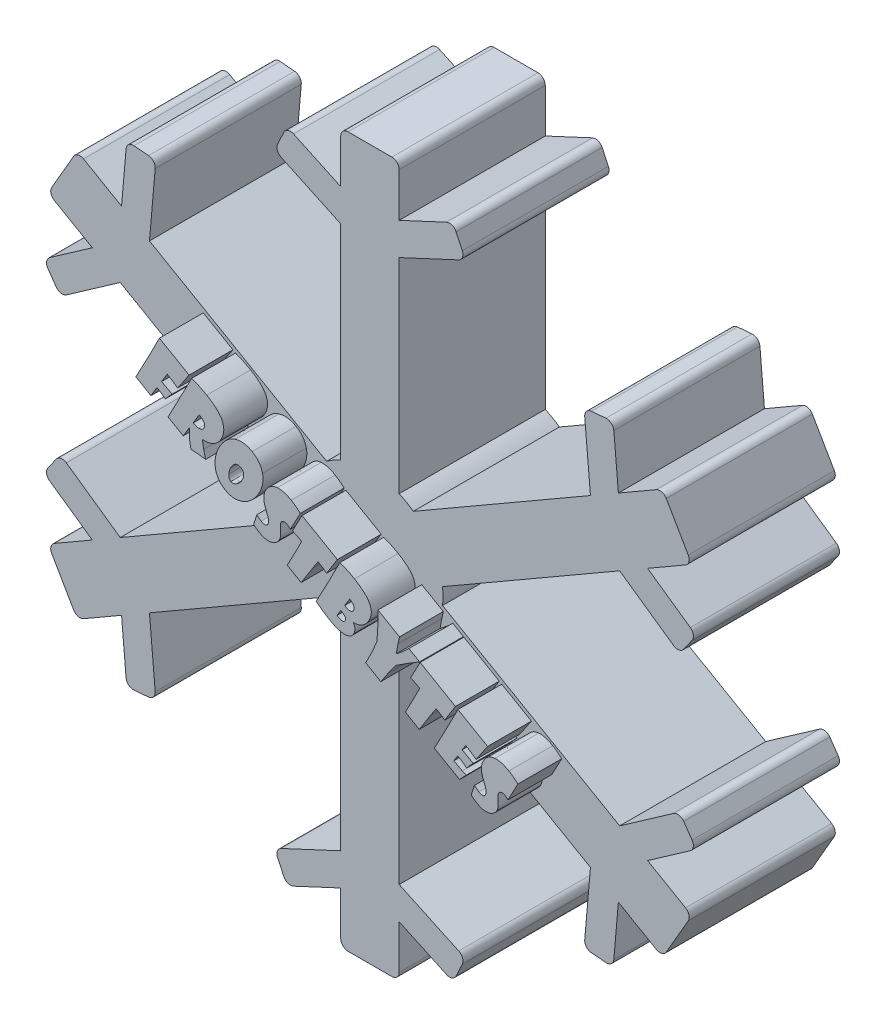
from build123d import *

# Parameters (mm, degrees)
SKETCH2_R           = 5
BOSS_EXTRUDE1_DEPTH = 10
BOSS_EXTRUDE2_DEPTH = 10
CIRPATTERN1_COUNT   = 6
BOSS_EXTRUDE3_DEPTH = 3


with BuildPart() as part:
    # Sketch2 → Boss-Extrude1 (new body)
    with BuildSketch(Plane.XY):
        Circle(SKETCH2_R)
    extrude(amount=-BOSS_EXTRUDE1_DEPTH)

    # Sketch3 → Boss-Extrude2 (add)
    with BuildSketch(Plane.XY):
        Polygon((-2, 18.582575695), (-2, 4.582575695), (0, 4.582575695), (2, 4.582575695), (2, 18.582575695), (0, 18.582575695), align=None)
        with BuildLine():
            Line((-6.078385042, 20.484357873), (-2, 18.582575695))
            Line((-2, 18.582575695), (0, 18.582575695))
            Line((0, 18.582575695), (0, 24.289331533))
            Line((0, 24.289331533), (-1.5, 24.289331533))
            ThreePointArc((-1.5, 24.289331533), (-1.853553391, 24.142884923), (-2, 23.789331533))
            Line((-2, 23.789331533), (-2, 20.789331533))
            Line((-2, 20.789331533), (-5.233148518, 22.296973447))
            ThreePointArc((-5.233148518, 22.296973447), (-5.615467721, 22.313665864), (-5.897611543, 22.055128684))
            Line((-5.897611543, 22.055128684), (-6.320229804, 21.148820897))
            ThreePointArc((-6.320229804, 21.148820897), (-6.336922221, 20.766501695), (-6.078385042, 20.484357873))
        make_face()
        with BuildLine():
            Line((0, 24.289331533), (0, 18.582575695))
            Line((0, 18.582575695), (2, 18.582575695))
            Line((2, 18.582575695), (6.078385042, 20.484357873))
            ThreePointArc((6.078385042, 20.484357873), (6.336922221, 20.766501695), (6.320229804, 21.148820897))
            Line((6.320229804, 21.148820897), (5.897611543, 22.055128684))
            ThreePointArc((5.897611543, 22.055128684), (5.615467721, 22.313665864), (5.233148518, 22.296973447))
            Line((5.233148518, 22.296973447), (2, 20.789331533))
            Line((2, 20.789331533), (2, 23.789331533))
            ThreePointArc((2, 23.789331533), (1.853553391, 24.142884923), (1.5, 24.289331533))
            Line((1.5, 24.289331533), (0, 24.289331533))
        make_face()
    boss_extrude2 = extrude(amount=-BOSS_EXTRUDE2_DEPTH)

    # CirPattern1: Boss-Extrude2 ×6 about axis
    cirpattern1_axis = Axis((0, 0, 0), (0, 0, 1))
    for i in range(1, CIRPATTERN1_COUNT):
        add(boss_extrude2.rotate(cirpattern1_axis, i * 360 / CIRPATTERN1_COUNT))

    # Sketch4 → Boss-Extrude3 (add)
    # profile 1 of 10: a face of its own
    with BuildSketch(Plane.XY):
        with BuildLine():
            Line((-9.378683004, 7.426874525), (-10.163887479, 6.266959401))
            add(Edge.make_bspline(
                [(-10.163887479, 6.266959401), (-10.171047513, 6.272640723), (-10.187165293, 6.285429811), (-10.215057295, 6.305332481), (-10.248078043, 6.329718594), (-10.286482146, 6.358271247), (-10.331004494, 6.389749995), (-10.381162603, 6.424802307), (-10.43638991, 6.464250832), (-10.475539238, 6.491174207), (-10.496063405, 6.505288877)],
                knots=[0, 0, 0, 0, 0.536428421, 1.207541116, 2.010745698, 2.94604434, 4.016377097, 5.211130026, 6.537925522, 8, 8, 8, 8], degree=3))
            add(Edge.make_bspline(
                [(-10.496063405, 6.505288877), (-10.523708, 6.522676937), (-10.581280358, 6.558889137), (-10.67181167, 6.614163995), (-10.769998639, 6.673025086), (-10.838118521, 6.713275227), (-10.873474671, 6.734166192)],
                knots=[0, 0, 0, 0, 0.887834416, 1.84899509, 2.88356745, 4, 4, 4, 4], degree=3))
            Line((-10.873474671, 6.734166192), (-11.266414486, 6.096820513))
            add(Edge.make_bspline(
                [(-11.266414486, 6.096820513), (-11.245972067, 6.084827907), (-11.202583419, 6.059373827), (-11.132941804, 6.020378342), (-11.055033227, 5.977488834), (-10.968146942, 5.932016622), (-10.872940444, 5.882749631), (-10.769668846, 5.829800606), (-10.657215022, 5.774740385), (-10.579550616, 5.736526587), (-10.539273282, 5.71670863)],
                knots=[0, 0, 0, 0, 0.693056589, 1.470999547, 2.333960976, 3.293661248, 4.338596418, 5.468814886, 6.687308705, 8, 8, 8, 8], degree=3))
            add(Edge.make_bspline(
                [(-10.539273282, 5.71670863), (-10.553959532, 5.701911338), (-10.587260698, 5.668358382), (-10.641822425, 5.610412049), (-10.708565434, 5.540544745), (-10.756912014, 5.489645219), (-10.783003992, 5.462175451)],
                knots=[0, 0, 0, 0, 0.709865812, 1.609625323, 2.709947953, 4, 4, 4, 4], degree=3))
            add(Edge.make_bspline(
                [(-10.783003992, 5.462175451), (-10.799907177, 5.443292789), (-10.835209568, 5.403856253), (-10.890232438, 5.341384745), (-10.949252015, 5.273010397), (-10.989653894, 5.225016003), (-11.010530998, 5.200215574)],
                knots=[0, 0, 0, 0, 0.876433904, 1.830436725, 2.878908645, 4, 4, 4, 4], degree=3))
            add(Edge.make_bspline(
                [(-11.010530998, 5.200215574), (-11.01572087, 5.204474641), (-11.02770429, 5.214308831), (-11.047632629, 5.231425552), (-11.073281064, 5.250460078), (-11.103405825, 5.272927184), (-11.137411662, 5.299376692), (-11.176857434, 5.328252618), (-11.220689314, 5.360730823), (-11.251553067, 5.38341822), (-11.267764794, 5.395335173)],
                knots=[0, 0, 0, 0, 0.498986376, 1.15215995, 1.951693674, 2.871627046, 3.945487077, 5.153127236, 6.50463025, 8, 8, 8, 8], degree=3))
            add(Edge.make_bspline(
                [(-11.267764794, 5.395335173), (-11.319120259, 5.42953103), (-11.421357166, 5.497607109), (-11.528425565, 5.557798165), (-11.581711553, 5.587754154)],
                knots=[0, 0, 0, 0, 1.004636511, 2, 2, 2, 2], degree=3))
            Line((-11.581711553, 5.587754154), (-11.989504763, 4.90112221))
            Line((-11.989504763, 4.90112221), (-13.0265418, 5.499984093))
            Line((-13.0265418, 5.499984093), (-12.187324979, 7.074443969))
            add(Edge.make_bspline(
                [(-12.187324979, 7.074443969), (-12.161760442, 7.121633764), (-12.108240809, 7.220426107), (-12.027124771, 7.376708194), (-11.938310306, 7.546086583), (-11.843804266, 7.729628196), (-11.744165181, 7.9274843), (-11.638130396, 8.139127327), (-11.525124688, 8.364279642), (-11.448812691, 8.519665511), (-11.409547202, 8.59961758)],
                knots=[0, 0, 0, 0, 0.752299695, 1.574947481, 2.468124134, 3.433183194, 4.468725331, 5.573389339, 6.751414492, 8, 8, 8, 8], degree=3))
            Line((-11.409547202, 8.59961758), (-9.378683004, 7.426874525))
        make_face()
    # profile 2 of 10: a face of its own
    with BuildSketch(Plane.XY):
        with BuildLine():
            add(Edge.make_bspline(
                [(-7.210011759, 4.68709829), (-7.227964809, 4.657285687), (-7.263435695, 4.598383195), (-7.324733072, 4.516790065), (-7.390442324, 4.441216974), (-7.461649969, 4.37219955), (-7.537689842, 4.309239045), (-7.619560641, 4.253721283), (-7.705952126, 4.204088784), (-7.766774746, 4.176428839), (-7.797396018, 4.162503383)],
                knots=[0, 0, 0, 0, 1.041083224, 2.056928592, 3.049936458, 4.03604286, 5.021896133, 6.000959734, 6.993579095, 8, 8, 8, 8], degree=3))
            add(Edge.make_bspline(
                [(-7.797396018, 4.162503383), (-7.824959142, 4.151829648), (-7.879743627, 4.130614524), (-7.963503267, 4.104665593), (-8.048086667, 4.086284993), (-8.132743219, 4.072043913), (-8.217903435, 4.065936158), (-8.303381916, 4.064025315), (-8.389341679, 4.069719932), (-8.446484863, 4.077545463), (-8.475250956, 4.081484864)],
                knots=[0, 0, 0, 0, 1.025579071, 2.038441697, 3.038853042, 4.02748938, 5.014613074, 5.998766479, 6.99257155, 8, 8, 8, 8], degree=3))
            add(Edge.make_bspline(
                [(-8.475250956, 4.081484864), (-8.473944244, 4.069327153), (-8.470987846, 4.041820676), (-8.464913028, 3.995863175), (-8.455844905, 3.940573351), (-8.445062631, 3.875755679), (-8.432306456, 3.801207956), (-8.416625284, 3.717330528), (-8.399230928, 3.62385938), (-8.386209487, 3.558675166), (-8.379379043, 3.52448255)],
                knots=[0, 0, 0, 0, 0.519081358, 1.17440686, 1.967604465, 2.897422788, 3.963905213, 5.178180886, 6.519804552, 8, 8, 8, 8], degree=3))
            add(Edge.make_bspline(
                [(-8.379379043, 3.52448255), (-8.37636149, 3.507801259), (-8.370019344, 3.472741323), (-8.357340435, 3.418478426), (-8.34430007, 3.359295053), (-8.327481732, 3.296088756), (-8.310444409, 3.227643611), (-8.289804382, 3.154884041), (-8.267752904, 3.077399457), (-8.251842026, 3.024398768), (-8.243673024, 2.997187025)],
                knots=[0, 0, 0, 0, 0.74674368, 1.569470048, 2.454596578, 3.416528647, 4.450617862, 5.562010226, 6.748281328, 8, 8, 8, 8], degree=3))
            add(Edge.make_bspline(
                [(-8.243673024, 2.997187025), (-8.254254025, 2.998737386), (-8.27812462, 3.002234981), (-8.31828107, 3.008775922), (-8.36721994, 3.014365765), (-8.424647281, 3.020984581), (-8.490468642, 3.029662692), (-8.565096514, 3.037023858), (-8.648245773, 3.047113595), (-8.706590944, 3.052892597), (-8.737210833, 3.055925451)],
                knots=[0, 0, 0, 0, 0.516336929, 1.164849167, 1.964075622, 2.894058672, 3.956099243, 5.169257225, 6.51440953, 8, 8, 8, 8], degree=3))
            add(Edge.make_bspline(
                [(-8.737210833, 3.055925451), (-8.825858464, 3.063005531), (-8.998345566, 3.076781674), (-9.171089763, 3.086826311), (-9.255054197, 3.09170863)],
                knots=[0, 0, 0, 0, 1.027875488, 2, 2, 2, 2], degree=3))
            add(Edge.make_bspline(
                [(-9.255054197, 3.09170863), (-9.257343889, 3.101827608), (-9.262624136, 3.125162925), (-9.270534299, 3.165040616), (-9.280223338, 3.214245897), (-9.289750472, 3.273172196), (-9.302633034, 3.340898292), (-9.314020936, 3.418556393), (-9.328702212, 3.505047137), (-9.337970584, 3.566101392), (-9.342824259, 3.598074371)],
                knots=[0, 0, 0, 0, 0.48440063, 1.117073539, 1.898146086, 2.82584155, 3.903885049, 5.116651976, 6.490044222, 8, 8, 8, 8], degree=3))
            add(Edge.make_bspline(
                [(-9.342824259, 3.598074371), (-9.344483587, 3.617647711), (-9.348047465, 3.659687002), (-9.351885738, 3.727003676), (-9.355269007, 3.802851293), (-9.357877424, 3.887029165), (-9.359946611, 3.979753885), (-9.360979542, 4.081035317), (-9.362803678, 4.190854554), (-9.362540164, 4.266926382), (-9.362403734, 4.306311253)],
                knots=[0, 0, 0, 0, 0.665192515, 1.42868927, 2.283120734, 3.236266071, 4.280629215, 5.423920068, 6.666279219, 8, 8, 8, 8], degree=3))
            Line((-9.362403734, 4.306311253), (-9.365779506, 4.308336716))
            Line((-9.365779506, 4.308336716), (-9.781674567, 3.626430852))
            Line((-9.781674567, 3.626430852), (-10.818711604, 4.225292735))
            add(Edge.make_bspline(
                [(-10.818711604, 4.225292735), (-10.808852357, 4.244444605), (-10.788395259, 4.284183103), (-10.755693544, 4.345575292), (-10.721297516, 4.411761373), (-10.685102929, 4.482680282), (-10.645719005, 4.557731713), (-10.603947615, 4.63710271), (-10.560024854, 4.721145404), (-10.513459896, 4.809258101), (-10.464828883, 4.902087294), (-10.413539061, 4.998977449), (-10.360159262, 5.100571834), (-10.304096114, 5.206557929), (-10.24547206, 5.316999416), (-10.184495785, 5.431888878), (-10.122017906, 5.551449173), (-10.079016912, 5.632340401), (-10.05713753, 5.673498753)],
                knots=[0, 0, 0, 0, 0.631893803, 1.31112572, 2.040485056, 2.819991336, 3.646818842, 4.526837595, 5.451135075, 6.428626016, 7.450394756, 8.525358706, 9.644599657, 10.817037232, 12.042674043, 13.312585719, 14.632613849, 16, 16, 16, 16], degree=3))
            add(Edge.make_bspline(
                [(-10.05713753, 5.673498753), (-10.029469983, 5.725267849), (-9.971620242, 5.833511228), (-9.880796108, 6.002775013), (-9.784461266, 6.187327488), (-9.681270989, 6.386670483), (-9.57042647, 6.600177075), (-9.453846744, 6.828949726), (-9.329280715, 7.07160465), (-9.245037545, 7.238898409), (-9.201717006, 7.324926222)],
                knots=[0, 0, 0, 0, 0.757451549, 1.583746346, 2.478738699, 3.44380959, 4.480303991, 5.582984714, 6.757093258, 8, 8, 8, 8], degree=3))
            add(Edge.make_bspline(
                [(-9.201717006, 7.324926222), (-9.106255185, 7.287309831), (-8.919943208, 7.213894259), (-8.651719972, 7.095713009), (-8.401302019, 6.973607714), (-8.243516797, 6.885219242), (-8.166705431, 6.842190883)],
                knots=[0, 0, 0, 0, 1.076957108, 2.101887493, 3.075980549, 4, 4, 4, 4], degree=3))
            add(Edge.make_bspline(
                [(-8.166705431, 6.842190883), (-8.100527728, 6.802862685), (-7.972248196, 6.726628508), (-7.793448783, 6.603896794), (-7.631578735, 6.481023162), (-7.489733079, 6.35407459), (-7.364088196, 6.226991202), (-7.258666618, 6.095931848), (-7.169575024, 5.964269866), (-7.100086537, 5.829613323), (-7.048831013, 5.693016026), (-7.015763404, 5.554428345), (-7.002636096, 5.413635315), (-7.006245998, 5.271096203), (-7.030387582, 5.126658862), (-7.070928604, 4.980236404), (-7.130911021, 4.8320573), (-7.183140088, 4.736342973), (-7.210011759, 4.68709829)],
                knots=[0, 0, 0, 0, 1.375608696, 2.666493857, 3.874142024, 5.005243674, 6.066282712, 7.064525051, 8.007246843, 8.903177448, 9.766156253, 10.609160338, 11.441696234, 12.286770737, 13.150443007, 14.052206133, 14.997866935, 16, 16, 16, 16], degree=3))
        make_face()
        with BuildLine():
            add(Edge.make_bspline(
                [(-8.361149876, 4.789721747), (-8.352817742, 4.805495369), (-8.336596766, 4.836203414), (-8.320450681, 4.884506911), (-8.311293702, 4.932665471), (-8.309796482, 4.98079026), (-8.316710004, 5.028974793), (-8.332131681, 5.07621424), (-8.353865945, 5.123919343), (-8.373748961, 5.153665204), (-8.384105123, 5.169158475)],
                knots=[0, 0, 0, 0, 1.056928542, 2.057625645, 3.008255778, 3.956632785, 4.900770688, 5.880492904, 6.896044779, 8, 8, 8, 8], degree=3))
            add(Edge.make_bspline(
                [(-8.384105123, 5.169158475), (-8.402112514, 5.192286527), (-8.439544512, 5.240362849), (-8.511617916, 5.302845564), (-8.594844086, 5.363996047), (-8.657749683, 5.398324396), (-8.690625185, 5.416264957)],
                knots=[0, 0, 0, 0, 0.883805491, 1.83716808, 2.869668395, 4, 4, 4, 4], degree=3))
            Line((-8.690625185, 5.416264957), (-9.099768703, 4.730983321))
            add(Edge.make_bspline(
                [(-9.099768703, 4.730983321), (-9.068839999, 4.714241949), (-9.008248198, 4.681444265), (-8.913070737, 4.646094603), (-8.818072853, 4.621024767), (-8.754008209, 4.615540691), (-8.722357438, 4.612831315)],
                knots=[0, 0, 0, 0, 1.056401988, 2.069575854, 3.04628498, 4, 4, 4, 4], degree=3))
            add(Edge.make_bspline(
                [(-8.722357438, 4.612831315), (-8.702094962, 4.612103126), (-8.663037605, 4.610699491), (-8.606471148, 4.616802688), (-8.554513525, 4.629739739), (-8.506793691, 4.648770831), (-8.462922672, 4.673710799), (-8.424053414, 4.7062306), (-8.389211902, 4.744754158), (-8.370616741, 4.774551706), (-8.361149876, 4.789721747)],
                knots=[0, 0, 0, 0, 1.141415343, 2.200158897, 3.193623623, 4.149719455, 5.087215562, 6.024111068, 6.994067715, 8, 8, 8, 8], degree=3))
        make_face(mode=Mode.SUBTRACT)
    # profile 3 of 10: a face of its own
    with BuildSketch(Plane.XY):
        with BuildLine():
            add(Edge.make_bspline(
                [(-4.637338708, 2.747379926), (-4.670758748, 2.691958335), (-4.736478868, 2.582972423), (-4.846944871, 2.430862001), (-4.964765996, 2.292064897), (-5.089253993, 2.165472609), (-5.221944369, 2.052691642), (-5.36130364, 1.95241497), (-5.507840268, 1.86463637), (-5.611100288, 1.81763773), (-5.662898122, 1.794062025)],
                knots=[0, 0, 0, 0, 1.089539837, 2.142567384, 3.161675152, 4.153285455, 5.129220918, 6.090586319, 7.042189887, 8, 8, 8, 8], degree=3))
            add(Edge.make_bspline(
                [(-5.662898122, 1.794062025), (-5.717191865, 1.772871694), (-5.823235729, 1.731483784), (-5.985658853, 1.690192964), (-6.145574759, 1.668172178), (-6.303378546, 1.665149391), (-6.459064945, 1.682059698), (-6.611912052, 1.719254829), (-6.762681329, 1.774542421), (-6.858021925, 1.825514784), (-6.906532381, 1.851450142)],
                knots=[0, 0, 0, 0, 1.080353707, 2.110093647, 3.100203129, 4.068878689, 5.030566238, 5.996548287, 6.980619384, 8, 8, 8, 8], degree=3))
            add(Edge.make_bspline(
                [(-6.906532381, 1.851450142), (-6.931010109, 1.866030146), (-6.979681242, 1.8950208), (-7.048881512, 1.942857051), (-7.11393429, 1.993694248), (-7.174835129, 2.047081851), (-7.23189344, 2.103430919), (-7.284864321, 2.162499159), (-7.334308609, 2.224386165), (-7.378140704, 2.290027752), (-7.419875402, 2.357306591), (-7.456417192, 2.428053376), (-7.48851701, 2.501781407), (-7.51793111, 2.577905672), (-7.542058653, 2.657203309), (-7.56213855, 2.739310019), (-7.579537301, 2.824111237), (-7.586795635, 2.882124723), (-7.590463708, 2.911442426)],
                knots=[0, 0, 0, 0, 1.041698903, 2.071297927, 3.073932171, 4.059532113, 5.031429043, 6.004718875, 6.959742533, 7.925346539, 8.889406027, 9.853851876, 10.83407653, 11.829149501, 12.836636208, 13.862643462, 14.919865198, 16, 16, 16, 16], degree=3))
            add(Edge.make_bspline(
                [(-7.590463708, 2.911442426), (-7.595580799, 2.967658182), (-7.605802423, 3.079951723), (-7.60198635, 3.249442348), (-7.585521821, 3.419354306), (-7.552760872, 3.589396989), (-7.504999202, 3.759990403), (-7.442424602, 3.930590833), (-7.366591509, 4.102430668), (-7.304662516, 4.213380423), (-7.273141177, 4.26985292)],
                knots=[0, 0, 0, 0, 0.953679972, 1.905019324, 2.860981184, 3.837047255, 4.828513551, 5.852815478, 6.907101061, 8, 8, 8, 8], degree=3))
            add(Edge.make_bspline(
                [(-7.273141177, 4.26985292), (-7.237835962, 4.328746457), (-7.168978267, 4.443609747), (-7.052773082, 4.601512607), (-6.931783914, 4.743881793), (-6.804008553, 4.869525273), (-6.669294054, 4.977894266), (-6.528680089, 5.0699631), (-6.38159351, 5.145354128), (-6.278644701, 5.18196561), (-6.227327134, 5.200215574)],
                knots=[0, 0, 0, 0, 1.149712042, 2.242346326, 3.279764792, 4.276831872, 5.239485528, 6.17117485, 7.088373565, 8, 8, 8, 8], degree=3))
            add(Edge.make_bspline(
                [(-6.227327134, 5.200215574), (-6.178742229, 5.213916945), (-6.082604906, 5.241028515), (-5.935218711, 5.262162237), (-5.788384396, 5.267498434), (-5.641487377, 5.257942922), (-5.495028354, 5.229230782), (-5.348497906, 5.185771545), (-5.201908483, 5.126495434), (-5.107898155, 5.075149648), (-5.059985313, 5.048981006)],
                knots=[0, 0, 0, 0, 0.997746316, 1.974289333, 2.936591751, 3.90055082, 4.879364447, 5.88233167, 6.920719549, 8, 8, 8, 8], degree=3))
            add(Edge.make_bspline(
                [(-5.059985313, 5.048981006), (-5.013929803, 5.020832173), (-4.923786162, 4.965736957), (-4.800919165, 4.869511297), (-4.69160904, 4.765504347), (-4.596270442, 4.652551926), (-4.514653258, 4.530996138), (-4.447232031, 4.400639634), (-4.392058294, 4.262398978), (-4.367972425, 4.165543785), (-4.355799356, 4.116592889)],
                knots=[0, 0, 0, 0, 1.0747333, 2.103556571, 3.10258386, 4.076323989, 5.042653783, 6.013374427, 6.995953653, 8, 8, 8, 8], degree=3))
            add(Edge.make_bspline(
                [(-4.355799356, 4.116592889), (-4.345705487, 4.06297147), (-4.325428807, 3.955256147), (-4.318889985, 3.789743134), (-4.327290853, 3.62194382), (-4.35428136, 3.451472901), (-4.398512268, 3.278191999), (-4.46049762, 3.102376896), (-4.539799218, 2.92379205), (-4.604247671, 2.807229122), (-4.637338708, 2.747379926)],
                knots=[0, 0, 0, 0, 0.914241041, 1.836537909, 2.770338112, 3.729319629, 4.726474638, 5.766449518, 6.853184255, 8, 8, 8, 8], degree=3))
        make_face()
        with BuildLine():
            add(Edge.make_bspline(
                [(-5.783750745, 2.958028074), (-5.771347371, 2.979949484), (-5.747243622, 3.022549841), (-5.716335044, 3.086670969), (-5.69050937, 3.148145029), (-5.669821573, 3.207145825), (-5.655367072, 3.263699957), (-5.644289987, 3.317471734), (-5.640778875, 3.368892764), (-5.640652862, 3.417843677), (-5.647933072, 3.463976564), (-5.659028516, 3.508019048), (-5.677005141, 3.549062244), (-5.699279823, 3.588074206), (-5.727335971, 3.624090462), (-5.760735696, 3.657330336), (-5.799628659, 3.687921043), (-5.828348266, 3.705702733), (-5.843164326, 3.714876068)],
                knots=[0, 0, 0, 0, 1.401931289, 2.724403793, 3.959979524, 5.113009586, 6.200962845, 7.208456719, 8.16364144, 9.065833384, 9.926984777, 10.756662374, 11.587474443, 12.41269367, 13.252245929, 14.120477637, 15.030379652, 16, 16, 16, 16], degree=3))
            add(Edge.make_bspline(
                [(-5.843164326, 3.714876068), (-5.858103474, 3.72281312), (-5.887147334, 3.738243894), (-5.932059164, 3.756129942), (-5.976744086, 3.767686527), (-6.021243534, 3.773340939), (-6.065270439, 3.772420752), (-6.108911352, 3.766531821), (-6.152029635, 3.754059959), (-6.1945779, 3.735393845), (-6.23759213, 3.711936077), (-6.279166322, 3.681070296), (-6.320424175, 3.644917703), (-6.362108799, 3.603729398), (-6.402022635, 3.555347629), (-6.442864465, 3.502100809), (-6.482611517, 3.442333879), (-6.507925042, 3.399916035), (-6.521019264, 3.377974062)],
                knots=[0, 0, 0, 0, 0.945956761, 1.839076378, 2.697165055, 3.5217157, 4.340188137, 5.15390169, 5.978836741, 6.84180698, 7.749189241, 8.713731738, 9.731141506, 10.817277348, 11.987642319, 13.236632224, 14.570560526, 16, 16, 16, 16], degree=3))
            add(Edge.make_bspline(
                [(-6.521019264, 3.377974062), (-6.540657062, 3.341503008), (-6.579527409, 3.269313524), (-6.620712589, 3.15393725), (-6.650436068, 3.035895697), (-6.657771223, 2.955269419), (-6.661451363, 2.914818198)],
                knots=[0, 0, 0, 0, 1.0168484, 2.012712922, 3.002953005, 4, 4, 4, 4], degree=3))
            add(Edge.make_bspline(
                [(-6.661451363, 2.914818198), (-6.662300308, 2.892988756), (-6.663929784, 2.851089042), (-6.659939227, 2.790907245), (-6.650645895, 2.736297317), (-6.63605779, 2.687334638), (-6.615575492, 2.644046804), (-6.589845709, 2.606428921), (-6.558274113, 2.574499497), (-6.533499065, 2.558363143), (-6.521019264, 2.550234864)],
                knots=[0, 0, 0, 0, 1.271489729, 2.44051394, 3.504875424, 4.491526849, 5.405995273, 6.282095926, 7.134649455, 8, 8, 8, 8], degree=3))
            add(Edge.make_bspline(
                [(-6.521019264, 2.550234864), (-6.507944147, 2.543651112), (-6.481965858, 2.530570188), (-6.438793103, 2.519811957), (-6.393167794, 2.516598083), (-6.344681931, 2.520872723), (-6.293672556, 2.533076655), (-6.239513775, 2.551009844), (-6.183132991, 2.578140405), (-6.14569527, 2.600134795), (-6.126053986, 2.611673908)],
                knots=[0, 0, 0, 0, 0.835051384, 1.659121339, 2.523796393, 3.440809902, 4.430530964, 5.517172895, 6.697412408, 8, 8, 8, 8], degree=3))
            add(Edge.make_bspline(
                [(-6.126053986, 2.611673908), (-6.090701292, 2.634842789), (-6.020904852, 2.68058486), (-5.929364657, 2.764302677), (-5.847832797, 2.855290326), (-5.805095107, 2.923808326), (-5.783750745, 2.958028074)],
                knots=[0, 0, 0, 0, 1.029757104, 2.033038253, 3.017645936, 4, 4, 4, 4], degree=3))
        make_face(mode=Mode.SUBTRACT)
    # profile 4 of 10: a face of its own
    with BuildSketch(Plane.XY):
        with BuildLine():
            add(Edge.make_bspline(
                [(-2.448541103, 1.754903074), (-2.469318585, 1.775541876), (-2.507959399, 1.813924781), (-2.563808311, 1.864928746), (-2.613513586, 1.904740377), (-2.645972422, 1.925277367), (-2.66053956, 1.934494124)],
                knots=[0, 0, 0, 0, 1.261561633, 2.346182783, 3.257786582, 4, 4, 4, 4], degree=3))
            add(Edge.make_bspline(
                [(-2.66053956, 1.934494124), (-2.677148276, 1.943245945), (-2.710128842, 1.960624773), (-2.764565131, 1.975205889), (-2.821419797, 1.980876926), (-2.859718238, 1.977436612), (-2.87928956, 1.975678537)],
                knots=[0, 0, 0, 0, 0.991193243, 1.968250586, 2.961732632, 4, 4, 4, 4], degree=3))
            add(Edge.make_bspline(
                [(-2.87928956, 1.975678537), (-2.902128827, 1.971102555), (-2.946570084, 1.962198488), (-3.007042856, 1.931201599), (-3.058492012, 1.887272406), (-3.083350088, 1.849674636), (-3.096014097, 1.830520358)],
                knots=[0, 0, 0, 0, 1.030737973, 2.005637516, 2.983967022, 4, 4, 4, 4], degree=3))
            add(Edge.make_bspline(
                [(-3.096014097, 1.830520358), (-3.100335328, 1.821168999), (-3.110139031, 1.799953297), (-3.119608854, 1.761648534), (-3.126059836, 1.714377616), (-3.128784539, 1.658162036), (-3.130268935, 1.593097213), (-3.12882996, 1.518987479), (-3.123881439, 1.435700115), (-3.115939035, 1.34582133), (-3.109468241, 1.253815002), (-3.107892005, 1.164327695), (-3.111822683, 1.079739816), (-3.121143307, 0.999837177), (-3.135913719, 0.924617972), (-3.156020875, 0.854289225), (-3.181605158, 0.788917524), (-3.202985863, 0.748518135), (-3.213490949, 0.728668506)],
                knots=[0, 0, 0, 0, 0.43914428, 0.996299547, 1.67585826, 2.474968455, 3.397768154, 4.455088139, 5.639081474, 6.959945045, 8.308179942, 9.576899864, 10.779584403, 11.921566596, 13.00907288, 14.049308366, 15.041557174, 16, 16, 16, 16], degree=3))
            add(Edge.make_bspline(
                [(-3.213490949, 0.728668506), (-3.230022905, 0.701720187), (-3.2625585, 0.648684746), (-3.320395619, 0.577125142), (-3.38358523, 0.513514166), (-3.452886833, 0.458771802), (-3.527521195, 0.411482124), (-3.608527984, 0.374045721), (-3.694744672, 0.343450578), (-3.755222037, 0.331176922), (-3.786021813, 0.324926222)],
                knots=[0, 0, 0, 0, 1.046206342, 2.058978716, 3.039331037, 4.010201228, 4.978090998, 5.958414981, 6.960266171, 8, 8, 8, 8], degree=3))
            add(Edge.make_bspline(
                [(-3.786021813, 0.324926222), (-3.816117043, 0.320320504), (-3.876069487, 0.311145493), (-3.966764774, 0.307304583), (-4.057429393, 0.312001161), (-4.147753684, 0.325782709), (-4.238057659, 0.347189205), (-4.327595984, 0.378433343), (-4.417688534, 0.416278084), (-4.475627507, 0.448376703), (-4.505061165, 0.464683167)],
                knots=[0, 0, 0, 0, 0.975870205, 1.94402251, 2.905316635, 3.883213349, 4.870573673, 5.877163648, 6.921574944, 8, 8, 8, 8], degree=3))
            add(Edge.make_bspline(
                [(-4.505061165, 0.464683167), (-4.531478527, 0.480069134), (-4.582614146, 0.509851477), (-4.655271301, 0.555308383), (-4.722399589, 0.598016223), (-4.782414866, 0.640452518), (-4.837326008, 0.679657313), (-4.885125716, 0.718198908), (-4.926928904, 0.75481022), (-4.951686137, 0.779625411), (-4.963490949, 0.791457858)],
                knots=[0, 0, 0, 0, 1.299421351, 2.515266902, 3.64301562, 4.680658186, 5.639312259, 6.510334166, 7.289693466, 8, 8, 8, 8], degree=3))
            add(Edge.make_bspline(
                [(-4.963490949, 0.791457858), (-4.956493762, 0.811255179), (-4.940602332, 0.85621721), (-4.914360996, 0.932169568), (-4.881864447, 1.024028084), (-4.858996851, 1.090976929), (-4.846689252, 1.127009556)],
                knots=[0, 0, 0, 0, 0.709171499, 1.61061135, 2.714003955, 4, 4, 4, 4], degree=3))
            add(Edge.make_bspline(
                [(-4.846689252, 1.127009556), (-4.839395295, 1.149936672), (-4.82370345, 1.199260893), (-4.800471106, 1.279412333), (-4.773227301, 1.369905738), (-4.754998468, 1.434176976), (-4.745416103, 1.467962488)],
                knots=[0, 0, 0, 0, 0.811666975, 1.746178675, 2.815231974, 4, 4, 4, 4], degree=3))
            add(Edge.make_bspline(
                [(-4.745416103, 1.467962488), (-4.728079218, 1.453568804), (-4.695001632, 1.426106645), (-4.647634973, 1.386527391), (-4.604137819, 1.351703266), (-4.56444765, 1.32126885), (-4.52986887, 1.293994267), (-4.498614416, 1.272060826), (-4.472251524, 1.253177253), (-4.455385231, 1.243043651), (-4.447673048, 1.238410019)],
                knots=[0, 0, 0, 0, 1.437295765, 2.742261504, 3.93718262, 4.990982263, 5.93274193, 6.745418937, 7.426337563, 8, 8, 8, 8], degree=3))
            add(Edge.make_bspline(
                [(-4.447673048, 1.238410019), (-4.421865943, 1.224284753), (-4.373415885, 1.19776609), (-4.300663811, 1.169657937), (-4.233813826, 1.153455655), (-4.172633851, 1.151839534), (-4.116883168, 1.162225842), (-4.067964343, 1.187498445), (-4.02491622, 1.225523), (-4.003775099, 1.25826547), (-3.992619035, 1.275543506)],
                knots=[0, 0, 0, 0, 1.361562925, 2.556187616, 3.603320168, 4.531428687, 5.371769694, 6.201698765, 7.051045521, 8, 8, 8, 8], degree=3))
            add(Edge.make_bspline(
                [(-3.992619035, 1.275543506), (-3.978749323, 1.30297121), (-3.951102739, 1.357643022), (-3.932126159, 1.448966281), (-3.9311392, 1.544758242), (-3.94497045, 1.608104384), (-3.952109776, 1.640801994)],
                knots=[0, 0, 0, 0, 0.974445766, 1.942368834, 2.937904997, 4, 4, 4, 4], degree=3))
            add(Edge.make_bspline(
                [(-3.952109776, 1.640801994), (-3.988860898, 1.738223876), (-4.06240964, 1.933190899), (-4.135144506, 2.128463009), (-4.171534931, 2.22616079)],
                knots=[0, 0, 0, 0, 0.999367794, 2, 2, 2, 2], degree=3))
            add(Edge.make_bspline(
                [(-4.171534931, 2.22616079), (-4.187451163, 2.27271819), (-4.218456721, 2.363414157), (-4.249976563, 2.500812382), (-4.265734927, 2.634864427), (-4.266314123, 2.765710153), (-4.25345765, 2.893255042), (-4.223501061, 3.017249661), (-4.180256276, 3.138294851), (-4.139449829, 3.21414659), (-4.118872893, 3.252395358)],
                knots=[0, 0, 0, 0, 1.109720046, 2.161785977, 3.174038294, 4.149073326, 5.109169362, 6.058854288, 7.02116375, 8, 8, 8, 8], degree=3))
            add(Edge.make_bspline(
                [(-4.118872893, 3.252395358), (-4.095359671, 3.290522124), (-4.049560128, 3.364786229), (-3.969325732, 3.464434213), (-3.882361752, 3.550961749), (-3.78727761, 3.622465858), (-3.685882958, 3.681771966), (-3.576779476, 3.725318908), (-3.461015746, 3.756855631), (-3.380671237, 3.765274903), (-3.339744807, 3.769563568)],
                knots=[0, 0, 0, 0, 1.100475722, 2.143529472, 3.137384256, 4.109056438, 5.061007445, 6.016618086, 6.989691496, 8, 8, 8, 8], degree=3))
            add(Edge.make_bspline(
                [(-3.339744807, 3.769563568), (-3.302834822, 3.77146097), (-3.228275716, 3.775293771), (-3.114613463, 3.76672502), (-2.998257159, 3.749443488), (-2.879423603, 3.720559989), (-2.757945595, 3.681998637), (-2.634295471, 3.631897704), (-2.507128185, 3.573079618), (-2.423707641, 3.526192279), (-2.381025671, 3.502202457)],
                knots=[0, 0, 0, 0, 0.877255408, 1.772078154, 2.702146625, 3.669577175, 4.673976217, 5.72738525, 6.837220791, 8, 8, 8, 8], degree=3))
            add(Edge.make_bspline(
                [(-2.381025671, 3.502202457), (-2.330824999, 3.471849177), (-2.22720502, 3.409196507), (-2.075905418, 3.298223725), (-1.920003662, 3.173968919), (-1.819193434, 3.081325345), (-1.767310393, 3.033645358)],
                knots=[0, 0, 0, 0, 0.909438267, 1.87718548, 2.907471267, 4, 4, 4, 4], degree=3))
            Line((-1.767310393, 3.033645358), (-2.448541103, 1.754903074))
        make_face()
    # profile 5 of 10: a face of its own
    with BuildSketch(Plane.XY):
        with BuildLine():
            Line((0.771258913, 1.566535019), (0.029264314, 0.381639185))
            add(Edge.make_bspline(
                [(0.029264314, 0.381639185), (0.015358674, 0.392728028), (-0.016002951, 0.417736884), (-0.069694406, 0.458018383), (-0.134260234, 0.506738457), (-0.181555599, 0.541272171), (-0.207039698, 0.559879926)],
                knots=[0, 0, 0, 0, 0.720977765, 1.626033377, 2.720838689, 4, 4, 4, 4], degree=3))
            add(Edge.make_bspline(
                [(-0.207039698, 0.559879926), (-0.227252806, 0.572998342), (-0.273080072, 0.602740484), (-0.35093728, 0.650883353), (-0.444742276, 0.710187495), (-0.513486588, 0.751966723), (-0.550693248, 0.774579)],
                knots=[0, 0, 0, 0, 0.713575037, 1.617821167, 2.710687283, 4, 4, 4, 4], degree=3))
            add(Edge.make_bspline(
                [(-0.550693248, 0.774579), (-0.558094082, 0.763309205), (-0.575020024, 0.737534828), (-0.604491008, 0.694167574), (-0.639793851, 0.640435399), (-0.682138871, 0.576837659), (-0.729603602, 0.502195082), (-0.785266703, 0.418290066), (-0.846557958, 0.323670911), (-0.889409292, 0.257194469), (-0.911900809, 0.222302766)],
                knots=[0, 0, 0, 0, 0.490330258, 1.121400781, 1.906832077, 2.828472664, 3.900041421, 5.123617599, 6.490263926, 8, 8, 8, 8], degree=3))
            add(Edge.make_bspline(
                [(-0.911900809, 0.222302766), (-0.935762501, 0.184498072), (-0.986185291, 0.104611944), (-1.065635164, -0.021555), (-1.153550593, -0.159727203), (-1.248745566, -0.310798005), (-1.352622578, -0.473879627), (-1.465006854, -0.649304771), (-1.584090597, -0.838001009), (-1.667087796, -0.967373706), (-1.709933217, -1.034159426)],
                knots=[0, 0, 0, 0, 0.720824364, 1.523193584, 2.404041057, 3.361426311, 4.402300067, 5.521658063, 6.720612204, 8, 8, 8, 8], degree=3))
            Line((-1.709933217, -1.034159426), (-2.660550501, -0.484583808))
            add(Edge.make_bspline(
                [(-2.660550501, -0.484583808), (-2.641025213, -0.44764657), (-2.599431929, -0.368961886), (-2.531964937, -0.244179395), (-2.458901311, -0.10345469), (-2.37730194, 0.051655516), (-2.28690349, 0.221015115), (-2.190932449, 0.406321415), (-2.086006073, 0.605903933), (-2.013934208, 0.744174277), (-1.976619174, 0.815763414)],
                knots=[0, 0, 0, 0, 0.682475661, 1.453827715, 2.317106557, 3.272498929, 4.316757104, 5.45296172, 6.681277087, 8, 8, 8, 8], degree=3))
            add(Edge.make_bspline(
                [(-1.976619174, 0.815763414), (-1.925167734, 0.91809228), (-1.823530305, 1.120233228), (-1.723528431, 1.323188251), (-1.674150038, 1.423402303)],
                knots=[0, 0, 0, 0, 1.012450637, 2, 2, 2, 2], degree=3))
            Line((-1.674150038, 1.423402303), (-1.998224112, 1.594216346))
            Line((-1.998224112, 1.594216346), (-2.304069019, 1.72924721))
            Line((-2.304069019, 1.72924721), (-1.648494174, 2.964104463))
            Line((-1.648494174, 2.964104463), (0.771258913, 1.566535019))
        make_face()
    # profile 6 of 10: a face of its own
    with BuildSketch(Plane.XY):
        with BuildLine():
            add(Edge.make_bspline(
                [(2.918886025, -0.989599241), (2.901422454, -1.018380449), (2.867114022, -1.074923185), (2.810790746, -1.155385309), (2.750211343, -1.229094563), (2.686535258, -1.297414376), (2.618843534, -1.358541116), (2.548288801, -1.414750377), (2.473501198, -1.463875075), (2.421062357, -1.492064089), (2.394966272, -1.506092296)],
                knots=[0, 0, 0, 0, 1.08252476, 2.12669711, 3.155377666, 4.148720556, 5.127319676, 6.085880423, 7.047442222, 8, 8, 8, 8], degree=3))
            add(Edge.make_bspline(
                [(2.394966272, -1.506092296), (2.35066086, -1.526260651), (2.264259281, -1.565591687), (2.128931506, -1.602281973), (1.993727052, -1.618367181), (1.90458425, -1.611921751), (1.86024405, -1.608715753)],
                knots=[0, 0, 0, 0, 1.056743749, 2.060794033, 3.035426533, 4, 4, 4, 4], degree=3))
            add(Edge.make_bspline(
                [(1.86024405, -1.608715753), (1.876188468, -1.63254576), (1.908046179, -1.680159259), (1.940450029, -1.760555247), (1.962971283, -1.846034493), (1.970575009, -1.936231506), (1.968559475, -2.027252555), (1.953307672, -2.116039694), (1.926916343, -2.201316174), (1.899130407, -2.253635573), (1.88522476, -2.279819148)],
                knots=[0, 0, 0, 0, 0.969048035, 1.936204482, 2.920017999, 3.954104336, 4.991502272, 5.996797371, 6.997484524, 8, 8, 8, 8], degree=3))
            add(Edge.make_bspline(
                [(1.88522476, -2.279819148), (1.865880685, -2.310636606), (1.828213559, -2.370644907), (1.757447768, -2.447996985), (1.677637617, -2.510977644), (1.588301587, -2.559584514), (1.49000196, -2.59391085), (1.382769898, -2.615008269), (1.266431484, -2.620642923), (1.186627038, -2.614058299), (1.145255624, -2.610644765)],
                knots=[0, 0, 0, 0, 1.009149093, 1.965032975, 2.895535884, 3.821575722, 4.776621028, 5.777096051, 6.847624606, 8, 8, 8, 8], degree=3))
            add(Edge.make_bspline(
                [(1.145255624, -2.610644765), (1.111409985, -2.606201654), (1.041919899, -2.59707929), (0.936606564, -2.573134569), (0.82699959, -2.543250297), (0.714435509, -2.503380625), (0.597886297, -2.456748184), (0.477852197, -2.401916639), (0.354000153, -2.339002553), (0.271428133, -2.292299013), (0.22907121, -2.268341525)],
                knots=[0, 0, 0, 0, 0.831532842, 1.70725947, 2.629452474, 3.599096791, 4.615575674, 5.688215537, 6.814125235, 8, 8, 8, 8], degree=3))
            add(Edge.make_bspline(
                [(0.22907121, -2.268341525), (0.154155498, -2.223554444), (0.00127591, -2.13215799), (-0.224348437, -1.979574983), (-0.452440704, -1.812181119), (-0.601633367, -1.691264111), (-0.677661043, -1.629645537)],
                knots=[0, 0, 0, 0, 0.94317819, 1.924732314, 2.942456176, 4, 4, 4, 4], degree=3))
            add(Edge.make_bspline(
                [(-0.677661043, -1.629645537), (-0.666625174, -1.609395449), (-0.643831416, -1.567570415), (-0.608483476, -1.502313265), (-0.570932805, -1.43252941), (-0.530851749, -1.357823946), (-0.488555848, -1.278598307), (-0.443918378, -1.194575395), (-0.396633085, -1.106142974), (-0.346820092, -1.013238164), (-0.294390853, -0.915800071), (-0.240918439, -0.812876511), (-0.183159443, -0.706307142), (-0.124772534, -0.594136437), (-0.062308246, -0.478435373), (0.001730875, -0.357528269), (0.067822549, -0.23179206), (0.112924774, -0.146546058), (0.135899914, -0.103121617)],
                knots=[0, 0, 0, 0, 0.639945882, 1.321760091, 2.059402969, 2.838919956, 3.674271925, 4.551501921, 5.479058728, 6.456944558, 7.476706298, 8.549381818, 9.675307396, 10.840184474, 12.058315027, 13.323835342, 14.636757732, 16, 16, 16, 16], degree=3))
            add(Edge.make_bspline(
                [(0.135899914, -0.103121617), (0.16148321, -0.053122773), (0.214897813, 0.051268329), (0.299965055, 0.213851846), (0.389736077, 0.390767897), (0.487465447, 0.580336845), (0.590347623, 0.784000483), (0.701451105, 1.00030299), (0.818009391, 1.230769293), (0.898133442, 1.388752394), (0.939333556, 1.469987951)],
                knots=[0, 0, 0, 0, 0.763090197, 1.593233356, 2.49306346, 3.458541983, 4.491001531, 5.593220777, 6.762424288, 8, 8, 8, 8], degree=3))
            add(Edge.make_bspline(
                [(0.939333556, 1.469987951), (0.975669326, 1.458357458), (1.050192674, 1.434503739), (1.163205049, 1.391902853), (1.281406507, 1.344266857), (1.403931475, 1.289351206), (1.531242253, 1.228566663), (1.662799969, 1.160561065), (1.799709771, 1.087464468), (1.891652607, 1.034966779), (1.938561951, 1.008182395)],
                knots=[0, 0, 0, 0, 0.830012292, 1.702325155, 2.627116835, 3.602622741, 4.62328396, 5.69640917, 6.824705236, 8, 8, 8, 8], degree=3))
            add(Edge.make_bspline(
                [(1.938561951, 1.008182395), (2.002644286, 0.970103069), (2.126943168, 0.896241565), (2.301035458, 0.778645547), (2.458410352, 0.660470537), (2.598717352, 0.541459909), (2.720914291, 0.420095612), (2.826170458, 0.298063285), (2.914131655, 0.174548141), (2.985202219, 0.049952984), (3.038628942, -0.07644857), (3.073931386, -0.204267812), (3.092734285, -0.33313789), (3.093209739, -0.463298031), (3.076148359, -0.594530635), (3.040674585, -0.726378375), (2.989483656, -0.859864572), (2.942867545, -0.945529285), (2.918886025, -0.989599241)],
                knots=[0, 0, 0, 0, 1.41724713, 2.748998386, 3.992633513, 5.158189889, 6.244557628, 7.264360813, 8.219040603, 9.123550707, 9.986700552, 10.821460573, 11.638502778, 12.455903551, 13.288752635, 14.147189818, 15.046827325, 16, 16, 16, 16], degree=3))
        make_face()
        with BuildLine():
            add(Edge.make_bspline(
                [(1.879148371, -0.893727327), (1.890939305, -0.870135443), (1.913768763, -0.824457134), (1.923697696, -0.748058812), (1.91293566, -0.671128217), (1.889793472, -0.624305208), (1.877798062, -0.600035197)],
                knots=[0, 0, 0, 0, 1.021022399, 1.976890644, 2.951351325, 4, 4, 4, 4], degree=3))
            add(Edge.make_bspline(
                [(1.877798062, -0.600035197), (1.863725673, -0.577378123), (1.83449012, -0.530307786), (1.772785775, -0.468717969), (1.69912401, -0.409036787), (1.641814546, -0.376206519), (1.61178726, -0.359005105)],
                knots=[0, 0, 0, 0, 0.877767878, 1.823573058, 2.859661377, 4, 4, 4, 4], degree=3))
            Line((1.61178726, -0.359005105), (1.266783402, -0.908580722))
            add(Edge.make_bspline(
                [(1.266783402, -0.908580722), (1.284905551, -0.919571035), (1.319818164, -0.94074405), (1.372215882, -0.96843686), (1.422001671, -0.992438375), (1.470183623, -1.011211088), (1.516023183, -1.026549381), (1.559944937, -1.036339823), (1.601648177, -1.043345523), (1.641317556, -1.04331552), (1.678957091, -1.041211323), (1.714268343, -1.033803991), (1.747367617, -1.021269082), (1.778305119, -1.004509794), (1.806958328, -0.983159178), (1.833609399, -0.957900775), (1.858114006, -0.927949386), (1.871983797, -0.905383798), (1.879148371, -0.893727327)],
                knots=[0, 0, 0, 0, 1.457086743, 2.807101033, 4.07392376, 5.255043701, 6.361085351, 7.393433165, 8.347661027, 9.260849499, 10.11425266, 10.93678932, 11.730128161, 12.540343675, 13.348190998, 14.180136654, 15.059932107, 16, 16, 16, 16], degree=3))
        make_face(mode=Mode.SUBTRACT)
        with BuildLine():
            add(Edge.make_bspline(
                [(1.309318124, -1.78020495), (1.317736151, -1.763689763), (1.333941756, -1.731896255), (1.341616759, -1.678838071), (1.33330246, -1.6262399), (1.31106946, -1.573935792), (1.272493293, -1.523295772), (1.22049721, -1.472938923), (1.154305018, -1.422049119), (1.103522109, -1.391457049), (1.076389883, -1.375112358)],
                knots=[0, 0, 0, 0, 0.842923255, 1.622717774, 2.402512293, 3.250816896, 4.193205672, 5.291626704, 6.552973883, 8, 8, 8, 8], degree=3))
            add(Edge.make_bspline(
                [(1.076389883, -1.375112358), (1.064326928, -1.368187618), (1.039687209, -1.354043187), (1.01392322, -1.342066582), (1.000772599, -1.335953407)],
                knots=[0, 0, 0, 0, 0.979147139, 2, 2, 2, 2], degree=3))
            Line((1.000772599, -1.335953407), (0.745564266, -1.759950321))
            add(Edge.make_bspline(
                [(0.745564266, -1.759950321), (0.778949991, -1.780199857), (0.841367749, -1.818058272), (0.934082072, -1.861161978), (1.018129014, -1.888755556), (1.094012208, -1.900902428), (1.162455545, -1.896354265), (1.222441579, -1.874101595), (1.273288166, -1.834599409), (1.297000567, -1.798800776), (1.309318124, -1.78020495)],
                knots=[0, 0, 0, 0, 1.468994929, 2.746424412, 3.83954462, 4.789600903, 5.622570452, 6.391986882, 7.164707441, 8, 8, 8, 8], degree=3))
        make_face(mode=Mode.SUBTRACT)
    # profile 7 of 10: a face of its own
    with BuildSketch(Plane.XY):
        with BuildLine():
            Line((6.399066911, -1.682982728), (5.631416448, -2.152890136))
            add(Edge.make_bspline(
                [(5.631416448, -2.152890136), (5.604178784, -2.169983763), (5.546955183, -2.205895761), (5.457554647, -2.262297885), (5.36095472, -2.32400756), (5.256573155, -2.389987283), (5.145689792, -2.46223585), (5.027331536, -2.539577534), (4.901053256, -2.620766963), (4.814879853, -2.677408278), (4.770594689, -2.706516679)],
                knots=[0, 0, 0, 0, 0.754049045, 1.584181433, 2.478663098, 3.441951044, 4.479749873, 5.581927112, 6.757334032, 8, 8, 8, 8], degree=3))
            add(Edge.make_bspline(
                [(4.770594689, -2.706516679), (4.753915601, -2.72922847), (4.719117828, -2.77661234), (4.664908703, -2.851513479), (4.605268472, -2.932719924), (4.542474797, -3.022196096), (4.472965333, -3.117218463), (4.399729743, -3.219873396), (4.321339316, -3.329196245), (4.267594457, -3.404393831), (4.239923393, -3.443110043)],
                knots=[0, 0, 0, 0, 0.744918991, 1.554133073, 2.444268563, 3.40837488, 4.443734818, 5.556538378, 6.741959935, 8, 8, 8, 8], degree=3))
            add(Edge.make_bspline(
                [(4.239923393, -3.443110043), (4.224842438, -3.466063626), (4.193343868, -3.514005223), (4.143800221, -3.589524819), (4.089211994, -3.671586077), (4.029760488, -3.760680777), (3.965771983, -3.856806587), (3.895759506, -3.959034405), (3.822834139, -4.069386889), (3.771473854, -4.144442849), (3.745035275, -4.183079179)],
                knots=[0, 0, 0, 0, 0.740434854, 1.546496234, 2.434999, 3.397541937, 4.434128005, 5.548151779, 6.737869501, 8, 8, 8, 8], degree=3))
            Line((3.745035275, -4.183079179), (2.707998238, -3.584217296))
            add(Edge.make_bspline(
                [(2.707998238, -3.584217296), (2.719687883, -3.561705335), (2.744598328, -3.513732706), (2.784728764, -3.43714476), (2.829369898, -3.350877887), (2.877471391, -3.254407863), (2.93108406, -3.148998097), (2.989225839, -3.034036399), (3.051956642, -2.909440404), (3.094906342, -2.82289059), (3.117141757, -2.778083037)],
                knots=[0, 0, 0, 0, 0.673405932, 1.435017231, 2.295438369, 3.25198559, 4.296715749, 5.434961607, 6.672058446, 8, 8, 8, 8], degree=3))
            add(Edge.make_bspline(
                [(3.117141757, -2.778083037), (3.126184874, -2.758296973), (3.146075554, -2.714776774), (3.177763412, -2.642863237), (3.214762426, -2.558635306), (3.257407175, -2.462235), (3.304629953, -2.3535168), (3.356444377, -2.232492927), (3.414173106, -2.099505214), (3.453664228, -2.006411912), (3.474298393, -1.957770537)],
                knots=[0, 0, 0, 0, 0.583548293, 1.28353661, 2.107959054, 3.051292935, 4.111116938, 5.287451038, 6.582689538, 8, 8, 8, 8], degree=3))
            add(Edge.make_bspline(
                [(3.474298393, -1.957770537), (3.476049138, -1.933686144), (3.479813442, -1.881901919), (3.486956522, -1.798923448), (3.493586601, -1.705288264), (3.499939398, -1.601032728), (3.508575328, -1.486322795), (3.516309696, -1.360704085), (3.525169326, -1.224553616), (3.531242049, -1.130256779), (3.534387127, -1.081420228)],
                knots=[0, 0, 0, 0, 0.659757973, 1.418555817, 2.275448016, 3.224357541, 4.272254569, 5.418309152, 6.66293632, 8, 8, 8, 8], degree=3))
            add(Edge.make_bspline(
                [(3.534387127, -1.081420228), (3.535591292, -1.048565001), (3.538106487, -0.979938732), (3.540429589, -0.872346844), (3.543646089, -0.755561759), (3.544454922, -0.629290195), (3.545855168, -0.493811596), (3.547613735, -0.349106636), (3.54710596, -0.195392245), (3.547178027, -0.089843425), (3.547215059, -0.035606185)],
                knots=[0, 0, 0, 0, 0.754373602, 1.575695893, 2.46929198, 3.434999345, 4.472997676, 5.578123783, 6.755496443, 8, 8, 8, 8], degree=3))
            Line((3.547215059, -0.035606185), (5.022427251, -0.887650938))
            add(Edge.make_bspline(
                [(5.022427251, -0.887650938), (5.019001696, -0.900916641), (5.011645275, -0.929404895), (5.001005718, -0.97513585), (4.989663816, -1.026528616), (4.976827255, -1.083240093), (4.962413759, -1.145475941), (4.947697028, -1.213474913), (4.932320696, -1.287146671), (4.921405257, -1.337984377), (4.915752868, -1.364309889)],
                knots=[0, 0, 0, 0, 0.673128841, 1.445552207, 2.306666691, 3.258935657, 4.302363577, 5.445328111, 6.677103102, 8, 8, 8, 8], degree=3))
            Line((4.915752868, -1.364309889), (4.800976633, -2.006381648))
            add(Edge.make_bspline(
                [(4.800976633, -2.006381648), (4.816961664, -1.99423748), (4.850581319, -1.968695913), (4.903462565, -1.928239331), (4.960617799, -1.882643824), (5.023563291, -1.833896559), (5.090442128, -1.779363861), (5.162517418, -1.720647839), (5.240061197, -1.658289906), (5.292977897, -1.614839827), (5.320170306, -1.592512049)],
                knots=[0, 0, 0, 0, 0.725591256, 1.526060687, 2.406440288, 3.368140871, 4.403493456, 5.525253025, 6.728296897, 8, 8, 8, 8], degree=3))
            add(Edge.make_bspline(
                [(5.320170306, -1.592512049), (5.343191969, -1.571428516), (5.39368484, -1.525186501), (5.474308273, -1.448247012), (5.566840526, -1.358253295), (5.63234707, -1.293899963), (5.667199627, -1.259660969)],
                knots=[0, 0, 0, 0, 0.778978404, 1.708514936, 2.780822339, 4, 4, 4, 4], degree=3))
            Line((5.667199627, -1.259660969), (6.399066911, -1.682982728))
        make_face()
    # profile 8 of 10: a face of its own
    with BuildSketch(Plane.XY):
        with BuildLine():
            Line((8.854162682, -3.100131648), (8.112168083, -4.285027481))
            add(Edge.make_bspline(
                [(8.112168083, -4.285027481), (8.098262443, -4.273938638), (8.066900818, -4.248929783), (8.013209363, -4.208648284), (7.948643535, -4.15992821), (7.90134817, -4.125394496), (7.87586407, -4.106786741)],
                knots=[0, 0, 0, 0, 0.720977765, 1.626033377, 2.720838689, 4, 4, 4, 4], degree=3))
            add(Edge.make_bspline(
                [(7.87586407, -4.106786741), (7.855650963, -4.093668325), (7.809823697, -4.063926183), (7.731966488, -4.015783314), (7.638161493, -3.956479171), (7.56941718, -3.914699944), (7.532210521, -3.892087666)],
                knots=[0, 0, 0, 0, 0.713575037, 1.617821167, 2.710687283, 4, 4, 4, 4], degree=3))
            add(Edge.make_bspline(
                [(7.532210521, -3.892087666), (7.524809687, -3.903357462), (7.507883745, -3.929131839), (7.478412761, -3.972499093), (7.443109917, -4.026231267), (7.400764898, -4.089829007), (7.353300167, -4.164471585), (7.297637066, -4.248376601), (7.23634581, -4.342995756), (7.193494477, -4.409472197), (7.171002959, -4.444363901)],
                knots=[0, 0, 0, 0, 0.490330258, 1.121400781, 1.906832077, 2.828472664, 3.900041421, 5.123617599, 6.490263926, 8, 8, 8, 8], degree=3))
            add(Edge.make_bspline(
                [(7.171002959, -4.444363901), (7.147141268, -4.482168595), (7.096718478, -4.562054722), (7.017268605, -4.688221666), (6.929353176, -4.82639387), (6.834158203, -4.977464672), (6.730281191, -5.140546294), (6.617896915, -5.315971438), (6.498813171, -5.504667676), (6.415815973, -5.634040373), (6.372970552, -5.700826092)],
                knots=[0, 0, 0, 0, 0.720824364, 1.523193584, 2.404041057, 3.361426311, 4.402300067, 5.521658063, 6.720612204, 8, 8, 8, 8], degree=3))
            Line((6.372970552, -5.700826092), (5.422353268, -5.151250475))
            add(Edge.make_bspline(
                [(5.422353268, -5.151250475), (5.441878555, -5.114313236), (5.483471839, -5.035628553), (5.550938831, -4.910846062), (5.624002457, -4.770121356), (5.705601829, -4.615011151), (5.796000279, -4.445651552), (5.89197132, -4.260345252), (5.996897696, -4.060762734), (6.068969561, -3.92249239), (6.106284595, -3.850903253)],
                knots=[0, 0, 0, 0, 0.682475661, 1.453827715, 2.317106557, 3.272498929, 4.316757104, 5.45296172, 6.681277087, 8, 8, 8, 8], degree=3))
            add(Edge.make_bspline(
                [(6.106284595, -3.850903253), (6.157736035, -3.748574387), (6.259373463, -3.546433438), (6.359375337, -3.343478416), (6.408753731, -3.243264364)],
                knots=[0, 0, 0, 0, 1.012450637, 2, 2, 2, 2], degree=3))
            Line((6.408753731, -3.243264364), (6.084679657, -3.072450321))
            Line((6.084679657, -3.072450321), (5.778834749, -2.937419457))
            Line((5.778834749, -2.937419457), (6.434409595, -1.702562204))
            Line((6.434409595, -1.702562204), (8.854162682, -3.100131648))
        make_face()
    # profile 9 of 10: a face of its own
    with BuildSketch(Plane.XY):
        with BuildLine():
            Line((11.053101522, -4.369421771), (10.267897047, -5.529336895))
            add(Edge.make_bspline(
                [(10.267897047, -5.529336895), (10.260689694, -5.524168863), (10.244701714, -5.512704683), (10.218200874, -5.493401085), (10.185629507, -5.471451629), (10.147866572, -5.445054356), (10.104785323, -5.414388559), (10.055385557, -5.381218674), (10.001489875, -5.3428169), (9.963230844, -5.316811183), (9.943147819, -5.303160197)],
                knots=[0, 0, 0, 0, 0.53783034, 1.193062244, 1.988033636, 2.919383143, 3.987136045, 5.194707162, 6.52743875, 8, 8, 8, 8], degree=3))
            add(Edge.make_bspline(
                [(9.943147819, -5.303160197), (9.913436782, -5.283813527), (9.852757464, -5.244301515), (9.759653934, -5.183474), (9.660448884, -5.123474174), (9.592752796, -5.082816322), (9.558309856, -5.062130105)],
                knots=[0, 0, 0, 0, 0.936857821, 1.913359537, 2.938342897, 4, 4, 4, 4], degree=3))
            Line((9.558309856, -5.062130105), (9.313228837, -5.438866216))
            add(Edge.make_bspline(
                [(9.313228837, -5.438866216), (9.333923298, -5.451261229), (9.378160331, -5.47775714), (9.449348497, -5.519882358), (9.530088081, -5.566353203), (9.620967329, -5.616715773), (9.720496341, -5.673009756), (9.829930012, -5.733004689), (9.949096428, -5.796968057), (10.031388024, -5.841671167), (10.074127757, -5.864888592)],
                knots=[0, 0, 0, 0, 0.663819655, 1.4189986, 2.276269493, 3.227290481, 4.278168846, 5.422889991, 6.661528041, 8, 8, 8, 8], degree=3))
            add(Edge.make_bspline(
                [(10.074127757, -5.864888592), (10.061300372, -5.877941836), (10.031071588, -5.908702875), (9.978955357, -5.961713286), (9.915176994, -6.030454234), (9.867803754, -6.080533796), (9.84187467, -6.107944148)],
                knots=[0, 0, 0, 0, 0.653236769, 1.539405965, 2.653228063, 4, 4, 4, 4], degree=3))
            add(Edge.make_bspline(
                [(9.84187467, -6.107944148), (9.824919908, -6.127007207), (9.789924927, -6.166353755), (9.736981172, -6.228896962), (9.681981481, -6.296769032), (9.644883344, -6.344191727), (9.625825288, -6.368553716)],
                knots=[0, 0, 0, 0, 0.904138902, 1.86616142, 2.903804348, 4, 4, 4, 4], degree=3))
            add(Edge.make_bspline(
                [(9.625825288, -6.368553716), (9.620413145, -6.363841021), (9.608024269, -6.353053242), (9.587102454, -6.334219285), (9.559385251, -6.313471717), (9.52678403, -6.287942867), (9.488511677, -6.259446526), (9.445145217, -6.226333217), (9.395120961, -6.191334929), (9.360436118, -6.165855915), (9.342260473, -6.152504333)],
                knots=[0, 0, 0, 0, 0.482962535, 1.105544189, 1.893200217, 2.811032715, 3.892349344, 5.103903839, 6.482379882, 8, 8, 8, 8], degree=3))
            add(Edge.make_bspline(
                [(9.342260473, -6.152504333), (9.321385157, -6.13913923), (9.275252509, -6.109603506), (9.197995195, -6.063081728), (9.10638901, -6.010135557), (9.040490819, -5.972645667), (9.005358467, -5.952658654)],
                knots=[0, 0, 0, 0, 0.759201867, 1.677770612, 2.761948091, 4, 4, 4, 4], degree=3))
            Line((9.005358467, -5.952658654), (8.742048282, -6.376655568))
            add(Edge.make_bspline(
                [(8.742048282, -6.376655568), (8.756222665, -6.384539321), (8.787475122, -6.401921852), (8.838361404, -6.430009), (8.897549816, -6.462641148), (8.96488191, -6.499886892), (9.04097466, -6.540610736), (9.124895589, -6.586307759), (9.217482152, -6.635230832), (9.281746699, -6.669850815), (9.3152543, -6.68790171)],
                knots=[0, 0, 0, 0, 0.596784535, 1.315823226, 2.138617302, 3.083668754, 4.147020419, 5.314127952, 6.599583573, 8, 8, 8, 8], degree=3))
            add(Edge.make_bspline(
                [(9.3152543, -6.68790171), (9.330966144, -6.695641425), (9.366829494, -6.713307849), (9.428125421, -6.740654795), (9.503547019, -6.772250308), (9.55830458, -6.795038757), (9.588016646, -6.807404025)],
                knots=[0, 0, 0, 0, 0.705580202, 1.610534657, 2.703449339, 4, 4, 4, 4], degree=3))
            add(Edge.make_bspline(
                [(9.588016646, -6.807404025), (9.583274739, -6.812114449), (9.572322166, -6.822994304), (9.55411983, -6.841930152), (9.532274531, -6.865525449), (9.50542315, -6.892482025), (9.475162974, -6.924548091), (9.440191601, -6.960480991), (9.401765128, -7.001260203), (9.37468815, -7.029549153), (9.36048964, -7.044383191)],
                knots=[0, 0, 0, 0, 0.488259423, 1.127752438, 1.91860954, 2.837075839, 3.906849173, 5.13934228, 6.499940581, 8, 8, 8, 8], degree=3))
            add(Edge.make_bspline(
                [(9.36048964, -7.044383191), (9.34420859, -7.061866837), (9.309789507, -7.098828278), (9.25682478, -7.158969057), (9.196335052, -7.223707281), (9.155140678, -7.270017171), (9.133637788, -7.29419029)],
                knots=[0, 0, 0, 0, 0.849536739, 1.795969971, 2.849526947, 4, 4, 4, 4], degree=3))
            Line((9.133637788, -7.29419029), (7.405242726, -6.296312204))
            Line((7.405242726, -6.296312204), (8.24175893, -4.719826864))
            add(Edge.make_bspline(
                [(8.24175893, -4.719826864), (8.267032624, -4.672827246), (8.320150818, -4.574047275), (8.40194234, -4.41857343), (8.490967159, -4.249409561), (8.584969686, -4.065946143), (8.686014417, -3.868576423), (8.792064368, -3.656936024), (8.905312714, -3.4315711), (8.982455151, -3.276597987), (9.022237325, -3.196678716)],
                knots=[0, 0, 0, 0, 0.748286729, 1.572688147, 2.463377351, 3.428770279, 4.463285375, 5.572568129, 6.748179081, 8, 8, 8, 8], degree=3))
            Line((9.022237325, -3.196678716), (11.053101522, -4.369421771))
        make_face()
    # profile 10 of 10: a face of its own
    with BuildSketch(Plane.XY):
        with BuildLine():
            add(Edge.make_bspline(
                [(12.444957507, -6.843862358), (12.424180026, -6.823223556), (12.385539211, -6.784840651), (12.3296903, -6.733836686), (12.279985024, -6.694025055), (12.247526189, -6.673488065), (12.232959051, -6.664271308)],
                knots=[0, 0, 0, 0, 1.261561633, 2.346182783, 3.257786582, 4, 4, 4, 4], degree=3))
            add(Edge.make_bspline(
                [(12.232959051, -6.664271308), (12.216350335, -6.655519487), (12.183369769, -6.638140659), (12.12893348, -6.623559543), (12.072078813, -6.617888506), (12.033780372, -6.62132882), (12.014209051, -6.623086895)],
                knots=[0, 0, 0, 0, 0.991193243, 1.968250586, 2.961732632, 4, 4, 4, 4], degree=3))
            add(Edge.make_bspline(
                [(12.014209051, -6.623086895), (11.991369784, -6.627662877), (11.946928527, -6.636566944), (11.886455755, -6.667563833), (11.835006599, -6.711493026), (11.810148523, -6.749090796), (11.797484514, -6.768245074)],
                knots=[0, 0, 0, 0, 1.030737973, 2.005637516, 2.983967022, 4, 4, 4, 4], degree=3))
            add(Edge.make_bspline(
                [(11.797484514, -6.768245074), (11.793163283, -6.777596433), (11.78335958, -6.798812135), (11.773889757, -6.837116898), (11.767438775, -6.884387816), (11.764714072, -6.940603396), (11.763229676, -7.005668219), (11.764668651, -7.079777953), (11.769617172, -7.163065317), (11.777559575, -7.252944102), (11.784030369, -7.34495043), (11.785606606, -7.434437737), (11.781675928, -7.519025616), (11.772355304, -7.598928255), (11.757584892, -7.67414746), (11.737477736, -7.744476207), (11.711893452, -7.809847908), (11.690512748, -7.850247297), (11.680007662, -7.870096926)],
                knots=[0, 0, 0, 0, 0.43914428, 0.996299547, 1.67585826, 2.474968455, 3.397768154, 4.455088139, 5.639081474, 6.959945045, 8.308179942, 9.576899864, 10.779584403, 11.921566596, 13.00907288, 14.049308366, 15.041557174, 16, 16, 16, 16], degree=3))
            add(Edge.make_bspline(
                [(11.680007662, -7.870096926), (11.663475706, -7.897045245), (11.630940111, -7.950080686), (11.573102991, -8.021640291), (11.509913381, -8.085251266), (11.440611778, -8.13999363), (11.365977416, -8.187283308), (11.284970627, -8.224719711), (11.198753939, -8.255314854), (11.138276574, -8.26758851), (11.107476798, -8.27383921)],
                knots=[0, 0, 0, 0, 1.046206342, 2.058978716, 3.039331037, 4.010201228, 4.978090998, 5.958414981, 6.960266171, 8, 8, 8, 8], degree=3))
            add(Edge.make_bspline(
                [(11.107476798, -8.27383921), (11.077381568, -8.278444928), (11.017429123, -8.287619939), (10.926733836, -8.291460849), (10.836069217, -8.286764271), (10.745744926, -8.272982723), (10.655440952, -8.251576227), (10.565902627, -8.220332089), (10.475810077, -8.182487348), (10.417871104, -8.150388729), (10.388437446, -8.134082265)],
                knots=[0, 0, 0, 0, 0.975870205, 1.94402251, 2.905316635, 3.883213349, 4.870573673, 5.877163648, 6.921574944, 8, 8, 8, 8], degree=3))
            add(Edge.make_bspline(
                [(10.388437446, -8.134082265), (10.362020084, -8.118696298), (10.310884465, -8.088913955), (10.23822731, -8.043457049), (10.171099022, -8.00074921), (10.111083745, -7.958312914), (10.056172603, -7.919108119), (10.008372895, -7.880566524), (9.966569707, -7.843955213), (9.941812473, -7.819140021), (9.930007662, -7.807307574)],
                knots=[0, 0, 0, 0, 1.299421351, 2.515266902, 3.64301562, 4.680658186, 5.639312259, 6.510334166, 7.289693466, 8, 8, 8, 8], degree=3))
            add(Edge.make_bspline(
                [(9.930007662, -7.807307574), (9.937004849, -7.787510253), (9.952896279, -7.742548222), (9.979137615, -7.666595864), (10.011634163, -7.574737348), (10.03450176, -7.507788503), (10.046809359, -7.471755876)],
                knots=[0, 0, 0, 0, 0.709171499, 1.61061135, 2.714003955, 4, 4, 4, 4], degree=3))
            add(Edge.make_bspline(
                [(10.046809359, -7.471755876), (10.054103316, -7.44882876), (10.069795161, -7.399504539), (10.093027504, -7.319353099), (10.12027131, -7.228859694), (10.138500143, -7.164588456), (10.148082507, -7.130802944)],
                knots=[0, 0, 0, 0, 0.811666975, 1.746178675, 2.815231974, 4, 4, 4, 4], degree=3))
            add(Edge.make_bspline(
                [(10.148082507, -7.130802944), (10.165419393, -7.145196628), (10.198496978, -7.172658787), (10.245863638, -7.212238041), (10.289360792, -7.247062167), (10.329050961, -7.277496582), (10.363629741, -7.304771165), (10.394884195, -7.326704606), (10.421247087, -7.345588179), (10.43811338, -7.355721781), (10.445825563, -7.360355413)],
                knots=[0, 0, 0, 0, 1.437295765, 2.742261504, 3.93718262, 4.990982263, 5.93274193, 6.745418937, 7.426337563, 8, 8, 8, 8], degree=3))
            add(Edge.make_bspline(
                [(10.445825563, -7.360355413), (10.471632668, -7.374480679), (10.520082726, -7.400999342), (10.5928348, -7.429107495), (10.659684785, -7.445309777), (10.72086476, -7.446925898), (10.776615443, -7.43653959), (10.825534268, -7.411266987), (10.86858239, -7.373242432), (10.889723512, -7.340499962), (10.900879575, -7.323221926)],
                knots=[0, 0, 0, 0, 1.361562925, 2.556187616, 3.603320168, 4.531428687, 5.371769694, 6.201698765, 7.051045521, 8, 8, 8, 8], degree=3))
            add(Edge.make_bspline(
                [(10.900879575, -7.323221926), (10.914749288, -7.295794223), (10.942395872, -7.24112241), (10.961372452, -7.149799151), (10.962359411, -7.05400719), (10.948528161, -6.990661048), (10.941388835, -6.957963438)],
                knots=[0, 0, 0, 0, 0.974445766, 1.942368834, 2.937904997, 4, 4, 4, 4], degree=3))
            add(Edge.make_bspline(
                [(10.941388835, -6.957963438), (10.904637712, -6.860541556), (10.83108897, -6.665574533), (10.758354105, -6.470302423), (10.72196368, -6.372604642)],
                knots=[0, 0, 0, 0, 0.999367794, 2, 2, 2, 2], degree=3))
            add(Edge.make_bspline(
                [(10.72196368, -6.372604642), (10.706047448, -6.326047242), (10.67504189, -6.235351275), (10.643522048, -6.09795305), (10.627763684, -5.963901005), (10.627184488, -5.83305528), (10.640040961, -5.70551039), (10.66999755, -5.581515771), (10.713242335, -5.460470581), (10.754048782, -5.384618842), (10.774625717, -5.346370074)],
                knots=[0, 0, 0, 0, 1.109720046, 2.161785977, 3.174038294, 4.149073326, 5.109169362, 6.058854288, 7.02116375, 8, 8, 8, 8], degree=3))
            add(Edge.make_bspline(
                [(10.774625717, -5.346370074), (10.79813894, -5.308243308), (10.843938483, -5.233979203), (10.924172879, -5.134331219), (11.011136858, -5.047803683), (11.106221, -4.976299574), (11.207615652, -4.916993467), (11.316719135, -4.873446524), (11.432482865, -4.841909801), (11.512827374, -4.833490529), (11.553753804, -4.829201864)],
                knots=[0, 0, 0, 0, 1.100475722, 2.143529472, 3.137384256, 4.109056438, 5.061007445, 6.016618086, 6.989691496, 8, 8, 8, 8], degree=3))
            add(Edge.make_bspline(
                [(11.553753804, -4.829201864), (11.590663789, -4.827304462), (11.665222894, -4.823471661), (11.778885148, -4.832040412), (11.895241452, -4.849321944), (12.014075008, -4.878205443), (12.135553016, -4.916766795), (12.25920314, -4.966867728), (12.386370426, -5.025685814), (12.46979097, -5.072573153), (12.512472939, -5.096562975)],
                knots=[0, 0, 0, 0, 0.877255408, 1.772078154, 2.702146625, 3.669577175, 4.673976217, 5.72738525, 6.837220791, 8, 8, 8, 8], degree=3))
            add(Edge.make_bspline(
                [(12.512472939, -5.096562975), (12.562673612, -5.126916255), (12.66629359, -5.189568925), (12.817593192, -5.300541707), (12.973494949, -5.424796513), (13.074305177, -5.517440088), (13.126188217, -5.565120074)],
                knots=[0, 0, 0, 0, 0.909438267, 1.87718548, 2.907471267, 4, 4, 4, 4], degree=3))
            Line((13.126188217, -5.565120074), (12.444957507, -6.843862358))
        make_face()
    extrude(amount=BOSS_EXTRUDE3_DEPTH)


solid = part.part
